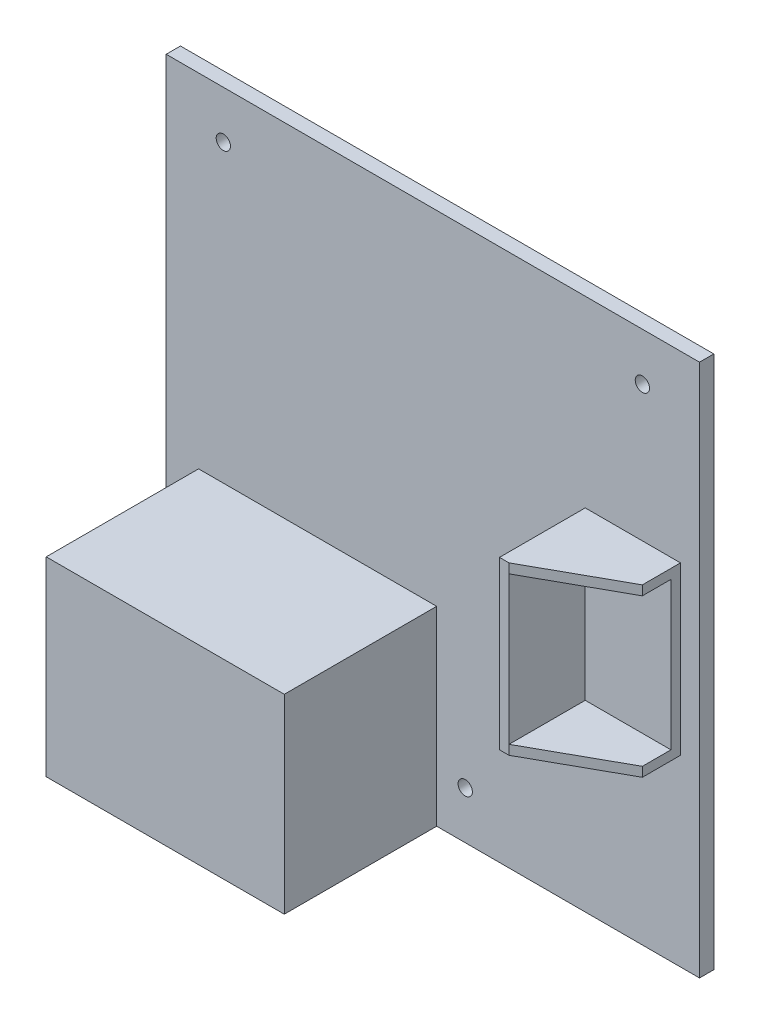
from build123d import *

# Parameters (mm, degrees)
SKETCH1_W           = 112
SKETCH1_H           = 112
BOSS_EXTRUDE1_DEPTH = 3
SKETCH2_W           = 50
SKETCH2_H           = 40
BOSS_EXTRUDE2_DEPTH = 32
CUT_EXTRUDE1_REACH  = 87.417
SKETCH3_R           = 1.5
SKETCH4_W           = 20
SKETCH4_H           = 35
BOSS_EXTRUDE3_DEPTH = 18
SKETCH5_W           = 18
SKETCH5_H           = 31
CUT_EXTRUDE2_DEPTH  = 16
CUT_EXTRUDE3_DEPTH  = 99.809159494


with BuildPart() as part:
    # Sketch1 → Boss-Extrude1 (new body)
    with BuildSketch(Plane.XY):
        Rectangle(SKETCH1_W, SKETCH1_H)
    extrude(amount=BOSS_EXTRUDE1_DEPTH)

    # Sketch2 → Boss-Extrude2 (add)
    with BuildSketch(Plane.XY.offset(3)):
        with Locations((-24.196765027, -36)):
            Rectangle(SKETCH2_W, SKETCH2_H)
    extrude(amount=BOSS_EXTRUDE2_DEPTH)

    # Sketch3 → Cut-Extrude1 (cut, up to next)
    with BuildSketch(Plane.XY.offset(3), mode=Mode.PRIVATE) as cut_extrude1_sk1:
        with Locations((-44, 46)):
            Circle(SKETCH3_R)
    cut_extrude1_tool1 = extrude(cut_extrude1_sk1.sketch, amount=-CUT_EXTRUDE1_REACH, mode=Mode.PRIVATE) & part.part
    # Sketch3 → Cut-Extrude1 (cut, up to next)
    with BuildSketch(Plane.XY.offset(3), mode=Mode.PRIVATE) as cut_extrude1_sk2:
        with Locations((44, 46)):
            Circle(SKETCH3_R)
    cut_extrude1_tool2 = extrude(cut_extrude1_sk2.sketch, amount=-CUT_EXTRUDE1_REACH, mode=Mode.PRIVATE) & part.part
    # Sketch3 → Cut-Extrude1 (cut, up to next)
    with BuildSketch(Plane.XY.offset(3), mode=Mode.PRIVATE) as cut_extrude1_sk3:
        with Locations((6.803234973, -46)):
            Circle(SKETCH3_R)
    cut_extrude1_tool3 = extrude(cut_extrude1_sk3.sketch, amount=-CUT_EXTRUDE1_REACH, mode=Mode.PRIVATE) & part.part
    add(cut_extrude1_tool1.solids().sort_by_distance((-44, 46, 3))[0], mode=Mode.SUBTRACT)
    add(cut_extrude1_tool2.solids().sort_by_distance((44, 46, 3))[0], mode=Mode.SUBTRACT)
    add(cut_extrude1_tool3.solids().sort_by_distance((6.803235, -46, 3))[0], mode=Mode.SUBTRACT)

    # Sketch4 → Boss-Extrude3 (add)
    with BuildSketch(Plane.XY.offset(3)):
        with Locations((42, 0)):
            Rectangle(SKETCH4_W, SKETCH4_H)
    extrude(amount=BOSS_EXTRUDE3_DEPTH)

    # Sketch5 → Cut-Extrude2 (cut)
    with BuildSketch(Plane.XY.offset(21)):
        with Locations((43, 0)):
            Rectangle(SKETCH5_W, SKETCH5_H)
    extrude(amount=-CUT_EXTRUDE2_DEPTH, mode=Mode.SUBTRACT)

    # Sketch6 → Cut-Extrude3 (cut, through all)
    with BuildSketch(Plane(origin=(0, 17.5, 0), x_dir=(1, 0, 0), z_dir=(0, 1, 0))):
        Polygon((34, -21), (52, -11), (52, -21), align=None)
    extrude(amount=-CUT_EXTRUDE3_DEPTH, mode=Mode.SUBTRACT)


solid = part.part
